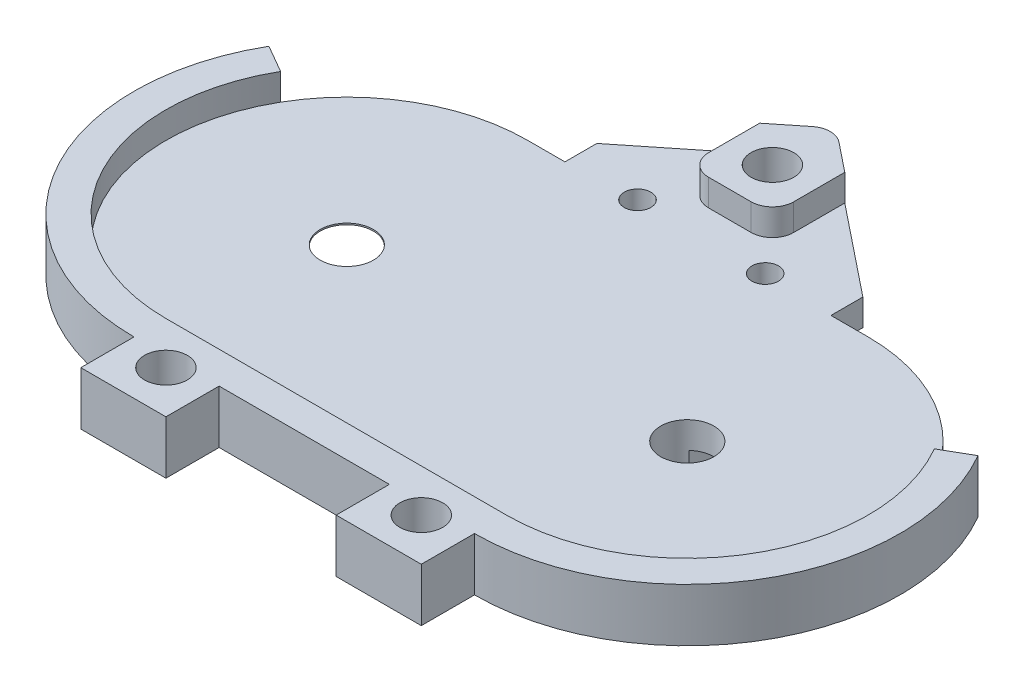
from build123d import *

# Parameters (mm, degrees)
SKETCH1_R                    = 3.175
SKETCH1_R_2                  = 1.5875
BOSS_EXTRUDE1_DEPTH          = 3.175
CUT_EXTRUDE1_REACH           = 61.599
BOSS_EXTRUDE2_DEPTH          = 3.175
TAP_DRILL_FOR_10_HELICOIL2_D = 5.1054
FILLET1_R                    = 2.54
CUT_EXTRUDE2_REACH           = 61.146
SKETCH20_W                   = 20.32
SKETCH20_H                   = 6.35
SKETCH22_R                   = 11.5
CUT_EXTRUDE3_DEPTH           = 3
BOSS_EXTRUDE4_START          = 2.75
BOSS_EXTRUDE4_DEPTH          = 2.75


with BuildPart() as part:
    # Sketch1 → Boss-Extrude1 (new body)
    with BuildSketch(Plane(origin=(0, 0, 0), x_dir=(1, 0, 0), z_dir=(0, 1, 0))):
        with BuildLine():
            Line((-20.32, 25.4), (-15.875, 25.4))
            Line((-15.875, 25.4), (0, 38.1))
            Line((0, 38.1), (15.875, 25.4))
            Line((15.875, 25.4), (20.32, 25.4))
            ThreePointArc((20.32, 25.4), (45.72, 0), (20.32, -25.4))
            Line((20.32, -25.4), (20.32, -31.75))
            Line((20.32, -31.75), (-20.32, -31.75))
            Line((-20.32, -31.75), (-20.32, -25.4))
            ThreePointArc((-20.32, -25.4), (-45.72, 0), (-20.32, 25.4))
        make_face()
        with Locations(Location((20.32, 0, 0), (0, 0, 270))):
            Circle(SKETCH1_R, mode=Mode.SUBTRACT)
        with Locations(Location((7.62, 21.997045256, 0), (0, 0, 270))):
            Circle(SKETCH1_R_2, mode=Mode.SUBTRACT)
        with Locations(Location((-20.32, 0, 0), (0, 0, 270))):
            Circle(SKETCH1_R, mode=Mode.SUBTRACT)
        with Locations(Location((-7.62, 21.997045256, 0), (0, 0, 270))):
            Circle(SKETCH1_R_2, mode=Mode.SUBTRACT)
    extrude(amount=BOSS_EXTRUDE1_DEPTH)

    # Sketch7 → Cut-Extrude1 (cut, up to next)
    with BuildSketch(Plane(origin=(0, 3.175, 0), x_dir=(1, 0, 0), z_dir=(0, 1, 0)), mode=Mode.PRIVATE) as cut_extrude1_sk1:
        with BuildLine():
            Line((-42.317045256, 12.7), (-39.017488468, 10.795))
            ThreePointArc((-39.017488468, 10.795), (-31.115, 18.697488468), (-20.32, 21.59))
            Line((-20.32, 21.59), (-15.875, 21.59))
            Line((-15.875, 21.59), (-15.875, 25.008038208))
            ThreePointArc((-15.875, 25.008038208), (-18.088875897, 25.301819801), (-20.32, 25.4))
            ThreePointArc((-20.32, 25.4), (-33.02, 21.997045256), (-42.317045256, 12.7))
        make_face()
    cut_extrude1_tool1 = extrude(cut_extrude1_sk1.sketch, amount=-CUT_EXTRUDE1_REACH, mode=Mode.PRIVATE) & part.part
    # Sketch7 → Cut-Extrude1 (cut, up to next)
    with BuildSketch(Plane(origin=(0, 3.175, 0), x_dir=(1, 0, 0), z_dir=(0, 1, 0)), mode=Mode.PRIVATE) as cut_extrude1_sk2:
        with BuildLine():
            Line((-15.875, 25.4), (-20.32, 25.4))
            ThreePointArc((-20.32, 25.4), (-18.088875897, 25.301819801), (-15.875, 25.008038208))
            Line((-15.875, 25.008038208), (-15.875, 25.4))
        make_face()
    cut_extrude1_tool2 = extrude(cut_extrude1_sk2.sketch, amount=-CUT_EXTRUDE1_REACH, mode=Mode.PRIVATE) & part.part
    cut_extrude1_1 = cut_extrude1_tool1.solids().sort_by_distance((-29.568041, 3.175, -20.060943))[0]
    add(cut_extrude1_1, mode=Mode.SUBTRACT)
    cut_extrude1_2 = cut_extrude1_tool2.solids().sort_by_distance((-16.984528, 3.175, -25.282569))[0]
    add(cut_extrude1_2, mode=Mode.SUBTRACT)
    cut_extrude1 = cut_extrude1_1 + cut_extrude1_2  # Cut-Extrude1 as one shape, for the pattern or mirror that repeats it

    # Sketch9 → Boss-Extrude2 (add)
    with BuildSketch(Plane(origin=(0, 3.175, 0), x_dir=(1, 0, 0), z_dir=(0, 1, 0))):
        with BuildLine():
            ThreePointArc((-20.32, -21.59), (-39.017488468, -10.795), (-39.017488468, 10.795))
            Line((-39.017488468, 10.795), (-42.317045256, 12.7))
            ThreePointArc((-42.317045256, 12.7), (-42.317045256, -12.7), (-20.32, -25.4))
            Line((-20.32, -25.4), (-20.32, -31.75))
            Line((-20.32, -31.75), (-10.16, -31.75))
            Line((-10.16, -31.75), (-10.16, -25.4))
            Line((-10.16, -25.4), (0, -25.4))
            Line((0, -25.4), (0, -21.59))
            Line((0, -21.59), (-20.32, -21.59))
        make_face()
        Polygon((0, 25.4), (0, 38.1), (-5.08, 34.036), (-5.08, 25.4), align=None)
    boss_extrude2 = extrude(amount=BOSS_EXTRUDE2_DEPTH)

    # Mirror1: Cut-Extrude1, Boss-Extrude2 across plane
    add(cut_extrude1.mirror(Plane(origin=(0, 0, 0), x_dir=(0, 0, 1), z_dir=(1, 0, 0))), mode=Mode.SUBTRACT)
    add(boss_extrude2.mirror(Plane(origin=(0, 0, 0), x_dir=(0, 0, 1), z_dir=(1, 0, 0))))

    # Tap Drill for #10 Helicoil2 (through all)
    with Locations(Plane(origin=(0, 6.35, 0), x_dir=(1, 0, 0), z_dir=(0, 1, 0))):
        with Locations((-15.24, -26.67), (15.24, -26.67), (0, 30.48)):
            Hole(TAP_DRILL_FOR_10_HELICOIL2_D / 2)

    # Fillet1
    fillet1_edges = [part.edges().sort_by_distance(p)[0] for p in [
        (5.08, 4.7625, -25.4),
        (0, 3.175, -38.1),
        (-5.08, 4.7625, -25.4),
    ]]
    fillet(fillet1_edges, radius=FILLET1_R)

    # Sketch20 → Cut-Extrude2 (cut, up to next)
    with BuildSketch(Plane(origin=(0, 3.175, 0), x_dir=(1, 0, 0), z_dir=(0, 1, 0)), mode=Mode.PRIVATE) as cut_extrude2_sk1:
        with Locations((0, -28.575)):
            Rectangle(SKETCH20_W, SKETCH20_H)
    cut_extrude2_tool1 = extrude(cut_extrude2_sk1.sketch, amount=-CUT_EXTRUDE2_REACH, mode=Mode.PRIVATE) & part.part
    add(cut_extrude2_tool1.solids().sort_by_distance((0, 3.175, 28.575))[0], mode=Mode.SUBTRACT)

    # Sketch22 → Cut-Extrude3 (cut)
    with BuildSketch(Plane.XZ):
        with Locations(Location((-20.32, 0, 0), (0, 0, 270))):
            Circle(SKETCH22_R)
    extrude(amount=-CUT_EXTRUDE3_DEPTH, mode=Mode.SUBTRACT)

    # Sketch23 → Boss-Extrude4 (add)
    with BuildSketch(Plane.XZ.offset(BOSS_EXTRUDE4_START)):
        with BuildLine():
            Line((18.18, -2.3454264), (18.18, -12.75))
            ThreePointArc((18.18, -12.75), (16.715533906, -16.285533906), (13.18, -17.75))
            Line((13.18, -17.75), (-29.32, -17.75))
            ThreePointArc((-29.32, -17.75), (-32.855533906, -16.285533906), (-34.32, -12.75))
            Line((-34.32, -12.75), (-34.32, 12.75))
            ThreePointArc((-34.32, 12.75), (-32.855533906, 16.285533906), (-29.32, 17.75))
            Line((-29.32, 17.75), (13.18, 17.75))
            ThreePointArc((13.18, 17.75), (16.715533906, 16.285533906), (18.18, 12.75))
            Line((18.18, 12.75), (18.18, 2.3454264))
            ThreePointArc((18.18, 2.3454264), (17.145, 0), (18.18, -2.3454264))
        make_face()
        with BuildLine():
            Line((-29.32, 12.25), (9.68, 12.25))
            ThreePointArc((9.68, 12.25), (11.801320344, 11.371320344), (12.68, 9.25))
            Line((12.68, 9.25), (12.68, -9.25))
            ThreePointArc((12.68, -9.25), (11.801320344, -11.371320344), (9.68, -12.25))
            Line((9.68, -12.25), (-29.32, -12.25))
            ThreePointArc((-29.32, -12.25), (-31.441320344, -11.371320344), (-32.32, -9.25))
            Line((-32.32, -9.25), (-32.32, 9.25))
            ThreePointArc((-32.32, 9.25), (-31.441320344, 11.371320344), (-29.32, 12.25))
        make_face(mode=Mode.SUBTRACT)
    extrude(amount=-BOSS_EXTRUDE4_DEPTH)


solid = part.part
